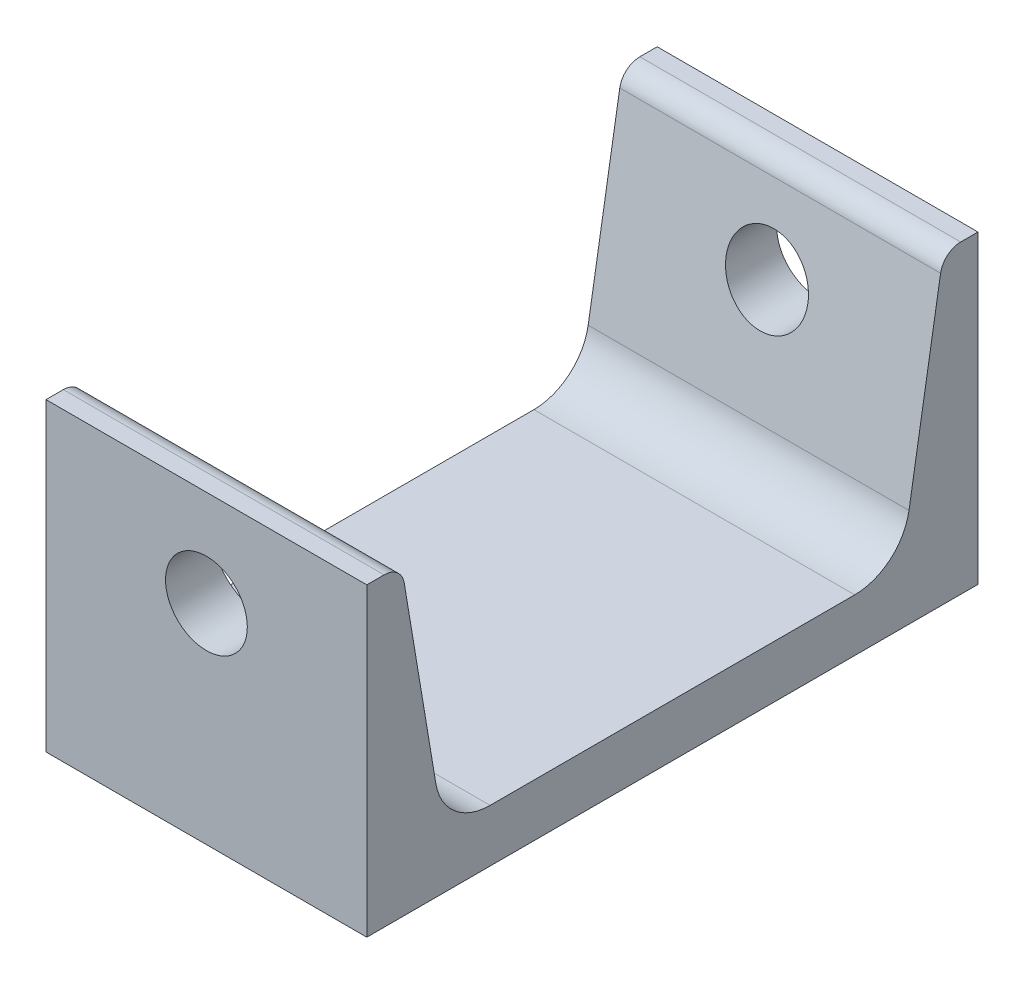
from build123d import *

# Parameters (mm, degrees)
MIEMBRO_ESTRUCTURAL1_DEPTH = 40
CROQUIS4_R                 = 5.1
CORTAR_EXTRUIR1_DEPTH      = 88.834257761


with BuildPart() as part:
    # Sketch1 → Miembro estructural1 (new body)
    with BuildSketch(Plane.YZ.offset(-18.536654135)):
        with BuildLine():
            Line((0, -38.1), (0, 38.1))
            Line((0, 38.1), (38.0492, 38.1))
            Line((38.0492, 38.1), (38.0492, 35.942335136))
            ThreePointArc((38.0492, 35.942335136), (37.447280466, 34.300554363), (35.926803066, 33.436899509))
            Line((35.926803066, 33.436899509), (12.283671721, 29.496090157))
            ThreePointArc((12.283671721, 29.496090157), (8.178382741, 27.164222052), (6.5532, 22.731413966))
            Line((6.5532, 22.731413966), (6.5532, -22.731413966))
            ThreePointArc((6.5532, -22.731413966), (8.178382741, -27.164222052), (12.283671721, -29.496090157))
            Line((12.283671721, -29.496090157), (35.926803066, -33.436899509))
            ThreePointArc((35.926803066, -33.436899509), (37.447280466, -34.300554363), (38.0492, -35.942335136))
            Line((38.0492, -35.942335136), (38.0492, -38.1))
            Line((38.0492, -38.1), (0, -38.1))
        make_face()
    extrude(amount=MIEMBRO_ESTRUCTURAL1_DEPTH)

    # Croquis4 → Cortar-Extruir1 (cut, through all)
    with BuildSketch(Plane.XY.offset(38.1)):
        with Locations((1.463345865, 26.0492)):
            Circle(CROQUIS4_R)
    extrude(amount=-CORTAR_EXTRUIR1_DEPTH, mode=Mode.SUBTRACT)


solid = part.part
